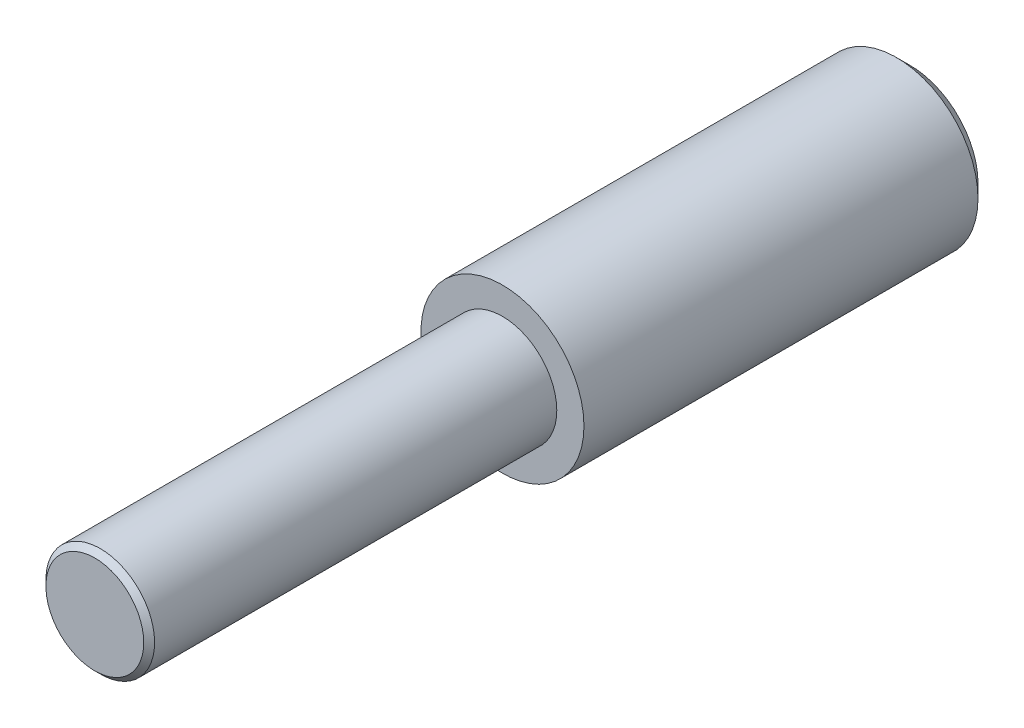
from build123d import *

# Parameters (mm, degrees)
SKETCH_1_R        = 3
EXTRUDE_175_DEPTH = 15
SKETCH_2_R        = 2
EXTRUDE_1_DEPTH   = 15
CHAMFER_1_SIZE    = 0.2
CHAMFER_2_SIZE    = 0.5


with BuildPart() as part:
    # Эскиз1 → Extrude 175 (new body)
    with BuildSketch(Plane.XY):
        Circle(SKETCH_1_R)
    extrude(amount=EXTRUDE_175_DEPTH)

    # Эскиз2 → Бобышка-Вытянуть1 (add)
    with BuildSketch(Plane.XY.offset(15)):
        Circle(SKETCH_2_R)
    extrude(amount=EXTRUDE_1_DEPTH)

    # Фаска1
    chamfer_1_edges = [part.edges().sort_by_distance(p)[0] for p in [
        (-2, 0, 30),
    ]]
    chamfer(chamfer_1_edges, length=CHAMFER_1_SIZE)

    # Фаска2
    chamfer_2_edges = [part.edges().sort_by_distance(p)[0] for p in [
        (-3, 0, 0),
    ]]
    chamfer(chamfer_2_edges, length=CHAMFER_2_SIZE)


solid = part.part
